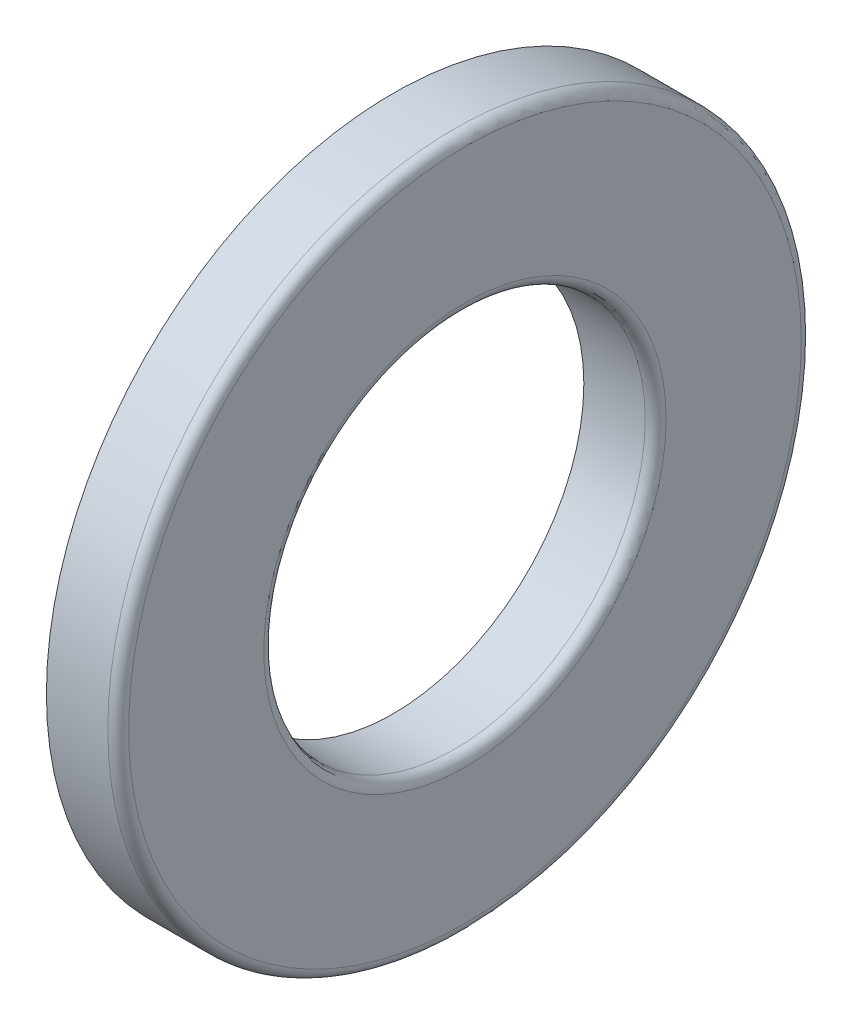
from build123d import *


with BuildPart() as part:
    # Croquis1 → Revolución1 (revolve)
    with BuildSketch(Plane.XY, mode=Mode.PRIVATE) as revoluci_n1_sk:
        with BuildLine():
            Line((9.858, 11), (13.4, 11))
            ThreePointArc((13.4, 11), (13.824264069, 11.175735931), (14, 11.6))
            Line((14, 11.6), (14, 19.4))
            ThreePointArc((14, 19.4), (13.824264069, 19.824264069), (13.4, 20))
            Line((13.4, 20), (9.858, 20))
            Line((9.858, 20), (9.858, 17.142666563))
            ThreePointArc((9.858, 17.142666563), (10.572, 15), (9.858, 12.857333437))
            Line((9.858, 12.857333437), (9.858, 11))
        make_face()
    revolve(revoluci_n1_sk.sketch.rotate(Axis((13.4, 0, 0), (-1, 0, 0)), 90), axis=Axis((13.4, 0, 0), (-1, 0, 0)))


solid = part.part
